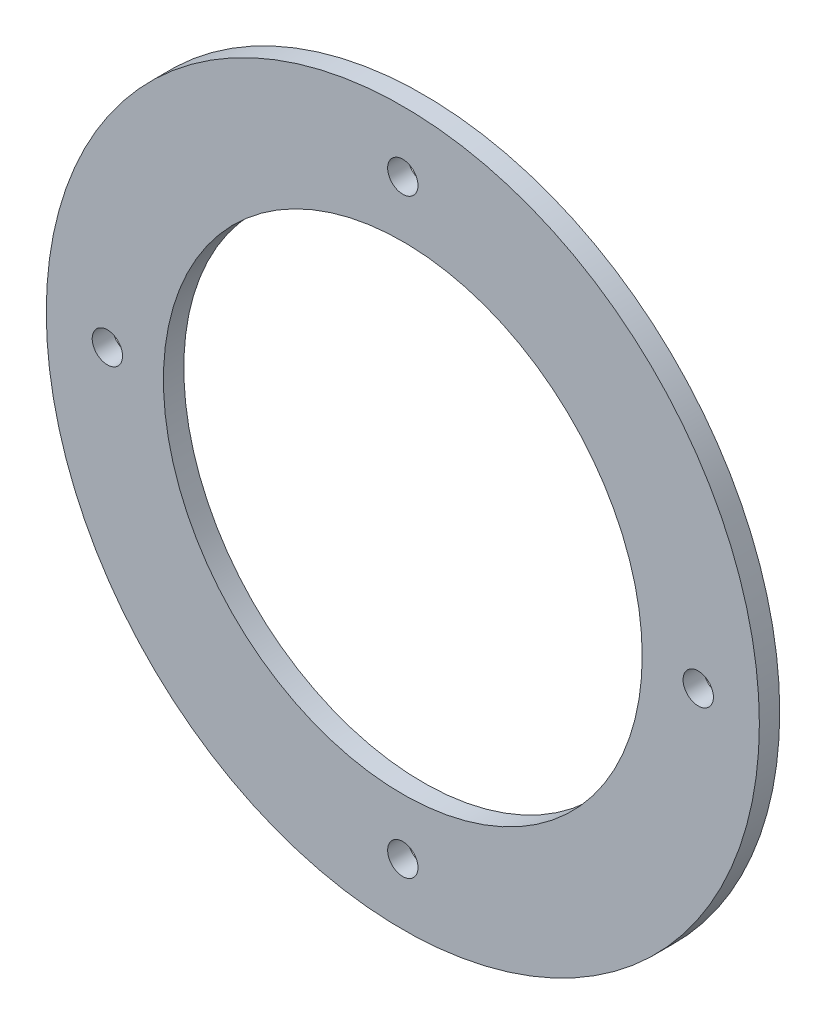
from build123d import *

# Parameters (mm, degrees)
SKETCH1_R           = 35
SKETCH1_R_2         = 23.5
SKETCH1_R_3         = 1.49
BOSS_EXTRUDE1_DEPTH = 2


with BuildPart() as part:
    # Sketch1 → Boss-Extrude1 (new body)
    with BuildSketch(Plane.XY):
        Circle(SKETCH1_R)
        Circle(SKETCH1_R_2, mode=Mode.SUBTRACT)
        with Locations((29, 0)):
            Circle(SKETCH1_R_3, mode=Mode.SUBTRACT)
        with Locations((0, 29)):
            Circle(SKETCH1_R_3, mode=Mode.SUBTRACT)
        with Locations((-29, 0)):
            Circle(SKETCH1_R_3, mode=Mode.SUBTRACT)
        with Locations((0, -29)):
            Circle(SKETCH1_R_3, mode=Mode.SUBTRACT)
    extrude(amount=BOSS_EXTRUDE1_DEPTH)


solid = part.part
